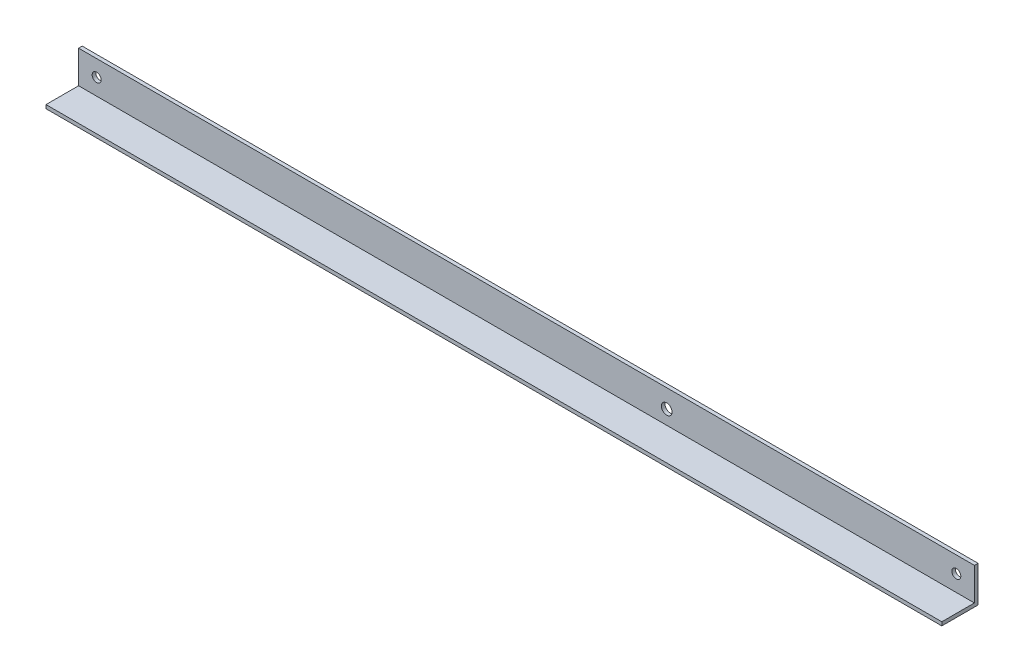
from build123d import *

# Parameters (mm, degrees)
BOSS_EXTRUDE1_DEPTH      = 170
BOSS_EXTRUDE1_DEPTH_BACK = 325
SKETCH3_R                = 2.95
SKETCH3_R_2              = 2.5
CUT_EXTRUDE1_DEPTH       = 2


with BuildPart() as part:
    # Sketch1 → Boss-Extrude1 (new, two sides: drawn at the far end of the back side and taken through both)
    with BuildSketch(Plane(origin=(0, 0, 0), x_dir=(0, 0, -1), z_dir=(1, 0, 0)).offset(-BOSS_EXTRUDE1_DEPTH_BACK)):
        Polygon((0, 20), (0, 0), (-20, 0), (-20, 2), (-2, 2), (-2, 20), align=None)
    extrude(amount=BOSS_EXTRUDE1_DEPTH + BOSS_EXTRUDE1_DEPTH_BACK)

    # Sketch3 → Cut-Extrude1 (cut)
    with BuildSketch(Plane.XY.offset(2)):
        with Locations((0, 9.8)):
            Circle(SKETCH3_R)
        with Locations((160, 11)):
            Circle(SKETCH3_R_2)
        with Locations((-315, 11)):
            Circle(SKETCH3_R_2)
    extrude(amount=-CUT_EXTRUDE1_DEPTH, mode=Mode.SUBTRACT)


solid = part.part
